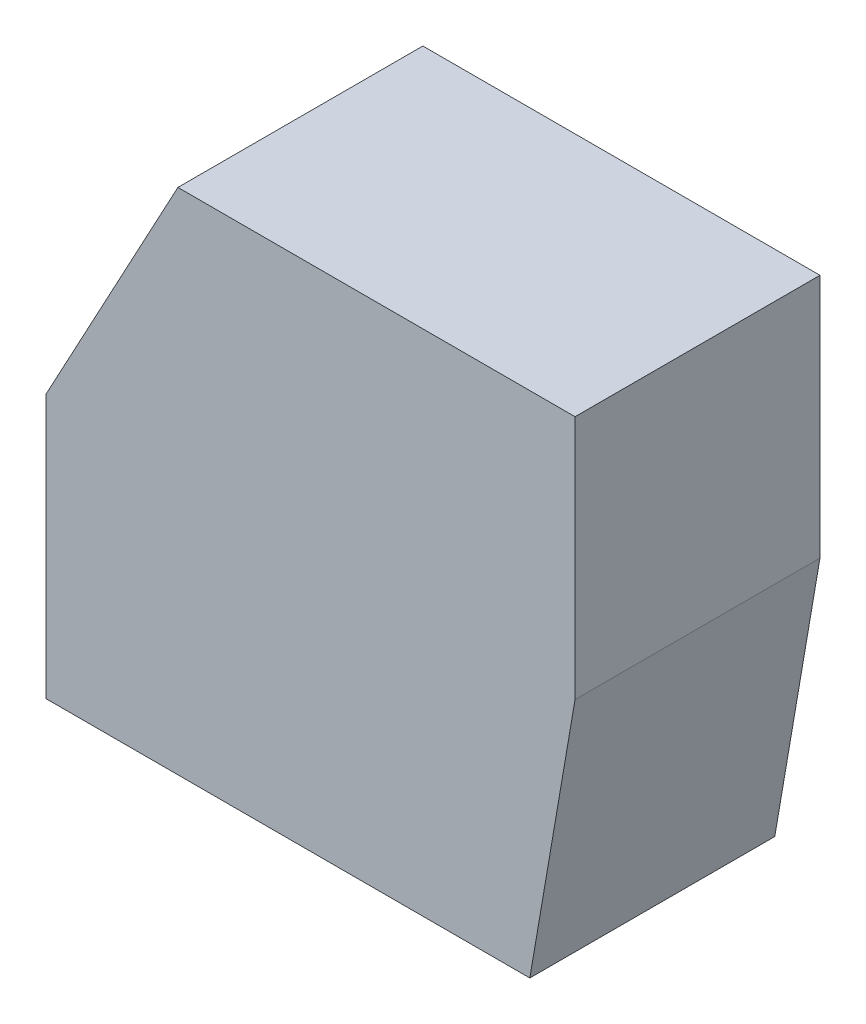
from build123d import *

# Parameters (mm, degrees)
AUFSATZ_LINEAR_AUSTRAGEN1_DEPTH = 65


with BuildPart() as part:
    # Skizze1 → Aufsatz-Linear austragen1 (new body)
    with BuildSketch(Plane.XY):
        Polygon((71.391208811, 100), (0, 100), (-35, 35), (-35, -35), (0, -35), (35, -35), (40.391208811, -35), (82.391208811, -35), (93.391208811, -35), (105.391208811, 35), (105.391208811, 100), align=None)
    extrude(amount=AUFSATZ_LINEAR_AUSTRAGEN1_DEPTH)


solid = part.part
